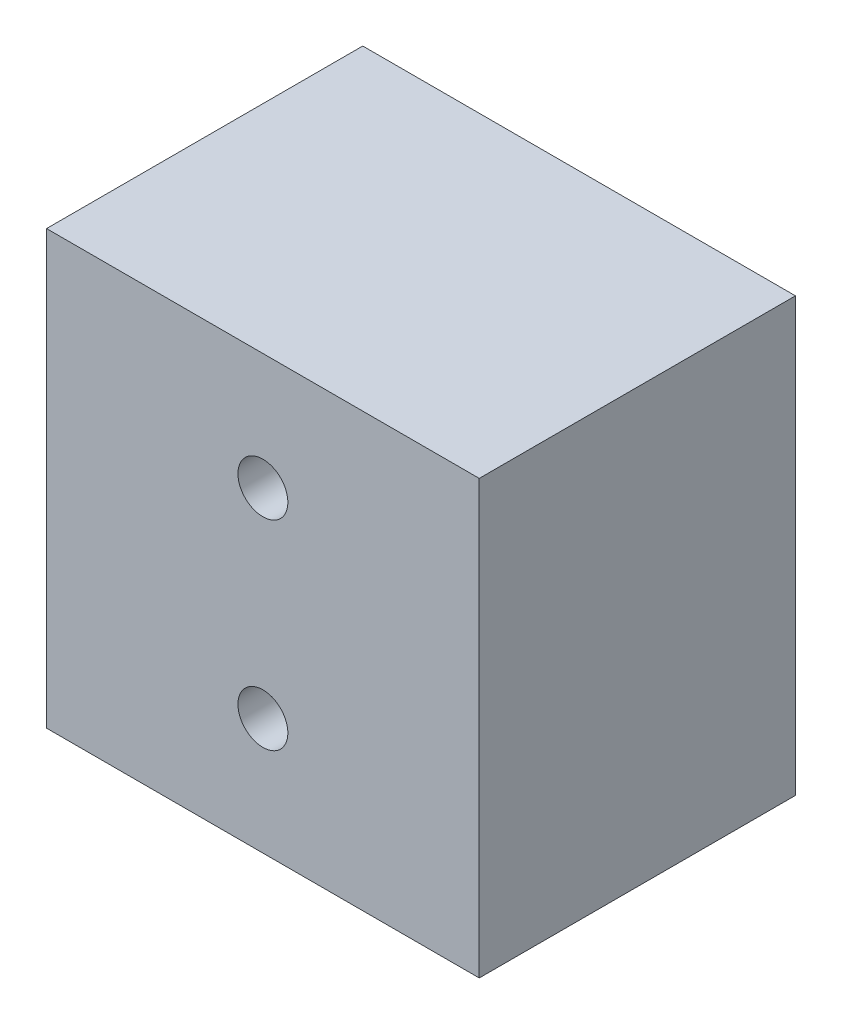
from build123d import *

# Parameters (mm, degrees)
SKETCH1_W           = 26
SKETCH1_H           = 26
SKETCH1_R           = 1.5
BOSS_EXTRUDE1_DEPTH = 20
SKETCH2_R           = 10
SKETCH2_R_2         = 3
CUT_EXTRUDE1_DEPTH  = 15
SKETCH2_7_R         = 3
SKETCH2_7_R_2       = 1.5
CUT_EXTRUDE3_DEPTH  = 17
CHAMFER1_SIZE       = 1
BOSS_EXTRUDE3_DEPTH = 3.5


with BuildPart() as part:
    # Sketch1 → Boss-Extrude1 (new body)
    with BuildSketch(Plane.XY):
        with Locations((2.653979239, -3.148788927)):
            Rectangle(SKETCH1_W, SKETCH1_H)
        with Locations((2.653979239, 2.851211073)):
            Circle(SKETCH1_R, mode=Mode.SUBTRACT)
        with Locations((2.653979239, -9.148788927)):
            Circle(SKETCH1_R, mode=Mode.SUBTRACT)
    extrude(amount=BOSS_EXTRUDE1_DEPTH)

    # Sketch2 → Cut-Extrude1 (cut)
    with BuildSketch(Plane(origin=(0, 0, 0), x_dir=(-1, 0, 0), z_dir=(0, 0, -1))):
        with Locations((-2.653979239, -3.148788927)):
            Circle(SKETCH2_R)
        with Locations((-2.653979239, 2.851211073)):
            Circle(SKETCH2_R_2, mode=Mode.SUBTRACT)
        with Locations((-2.653979239, -9.148788927)):
            Circle(SKETCH2_R_2, mode=Mode.SUBTRACT)
    extrude(amount=-CUT_EXTRUDE1_DEPTH, mode=Mode.SUBTRACT)

    # Sketch2<7> → Cut-Extrude3 (cut)
    # profile 1 of 2: a face of its own
    with BuildSketch(Plane(origin=(0, 0, 0), x_dir=(-1, 0, 0), z_dir=(0, 0, -1))):
        with Locations((-2.653979239, 2.851211073)):
            Circle(SKETCH2_7_R)
        with Locations((-2.653979239, 2.851211073)):
            Circle(SKETCH2_7_R_2, mode=Mode.SUBTRACT)
    # profile 2 of 2: a face of its own
    with BuildSketch(Plane(origin=(0, 0, 0), x_dir=(-1, 0, 0), z_dir=(0, 0, -1))):
        with Locations((-2.653979239, -9.148788927)):
            Circle(SKETCH2_7_R)
        with Locations((-2.653979239, -9.148788927)):
            Circle(SKETCH2_7_R_2, mode=Mode.SUBTRACT)
    extrude(amount=-CUT_EXTRUDE3_DEPTH, mode=Mode.SUBTRACT)

    # Chamfer1
    chamfer1_edges = [part.edges().sort_by_distance(p)[0] for p in [
        (2.653979239, -16.148788927, 0),
        (-10.346020761, -3.148788927, 0),
        (15.653979239, -3.148788927, 0),
        (2.653979239, 9.851211073, 0),
    ]]
    chamfer(chamfer1_edges, length=CHAMFER1_SIZE)

    # Sketch3 → Boss-Extrude3 (add)
    with BuildSketch(Plane(origin=(0, 0, 0), x_dir=(-1, 0, 0), z_dir=(0, 0, -1))):
        with BuildLine():
            ThreePointArc((-6.401290497, -5.897577855), (-7.381110484, -2.948788927), (-6.401290497, 0))
            Line((-6.401290497, 0), (-9.951669468, 3.466589231))
            Line((-9.951669468, 3.466589231), (-10.43206638, 3.877639536))
            ThreePointArc((-10.43206638, 3.877639536), (-12.953812767, -2.889662973), (-10.508439041, -9.684935993))
            Line((-10.508439041, -9.684935993), (-10.124893336, -9.364167085))
            Line((-10.124893336, -9.364167085), (-6.401290497, -5.897577855))
        make_face()
        with BuildLine():
            Line((5.043710991, 3.466589231), (1.49333202, 0))
            ThreePointArc((1.49333202, 0), (2.473152007, -2.948788927), (1.49333202, -5.897577855))
            Line((1.49333202, -5.897577855), (5.043710991, -9.364167085))
            Line((5.043710991, -9.364167085), (5.524107903, -9.77521739))
            ThreePointArc((5.524107903, -9.77521739), (8.045991974, -2.924201539), (5.492050202, 3.914928442))
            Line((5.492050202, 3.914928442), (5.043710991, 3.466589231))
        make_face()
    extrude(amount=-BOSS_EXTRUDE3_DEPTH)


solid = part.part
